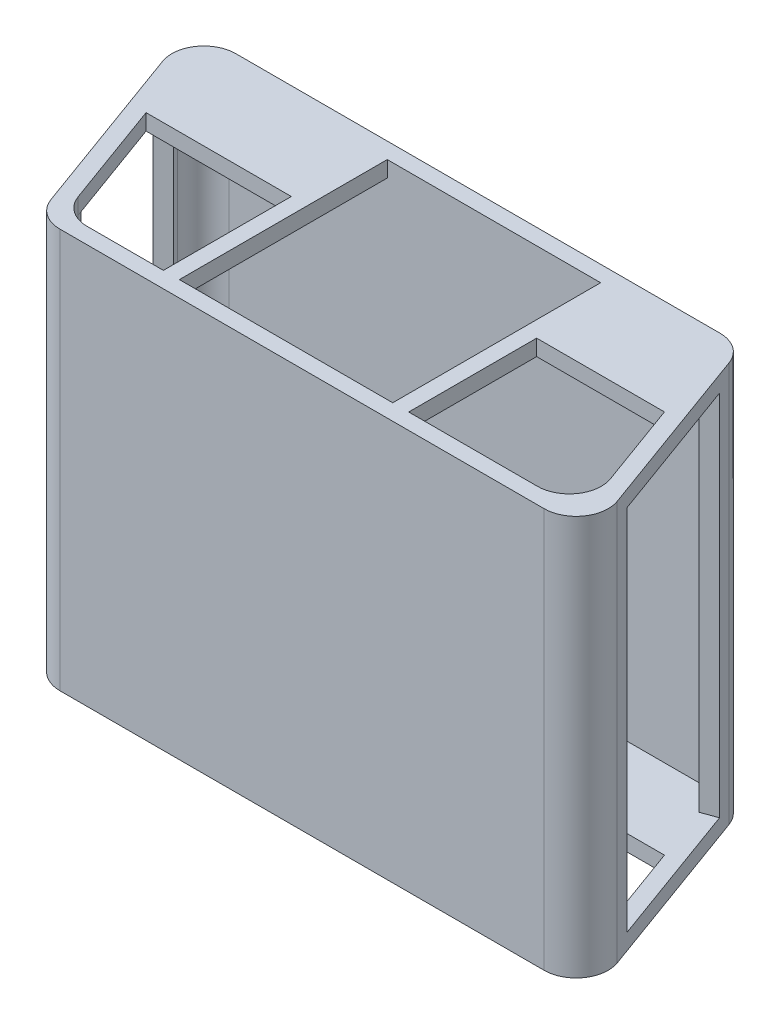
from build123d import *

# Parameters (mm, degrees)
BOSS_EXTRUDE1_DEPTH = 200
SKETCH2_W           = 2668.05
SKETCH2_H           = 2600
CUT_EXTRUDE1_DEPTH  = 230
BOSS_EXTRUDE2_DEPTH = 4600
SKETCH4_W           = 1941.19
SKETCH4_H           = 4600
CUT_EXTRUDE2_DEPTH  = 400
SKETCH5_W           = 1941.19
SKETCH5_H           = 4600
CUT_EXTRUDE3_DEPTH  = 400


with BuildPart() as part:
    # Sketch1 → Boss-Extrude1 (new body)
    with BuildSketch(Plane(origin=(0, 0, 0), x_dir=(1, 0, 0), z_dir=(0, 1, 0))):
        with BuildLine():
            Line((0, 0), (6056.75, 0))
            ThreePointArc((6056.75, 0), (6286.18, -72.339450634), (6432.625169, -263.192623242))
            Line((6432.625169, -263.192623242), (7233.3436263, -2463.197297837))
            ThreePointArc((7233.3436263, -2463.197297837), (7185.1256028, -2829.434418192), (6857.4656028, -3000.002675837))
            Line((6857.4656028, -3000.002675837), (800.7156028, -3000.002675837))
            ThreePointArc((800.7156028, -3000.002675837), (571.2856028, -2927.663225203), (424.8404338, -2736.810052595))
            Line((424.8404338, -2736.810052595), (-375.8780235, -536.805378))
            ThreePointArc((-375.8780235, -536.805378), (-327.66, -170.568257645), (0, 0))
        make_face()
    boss_extrude1 = extrude(amount=BOSS_EXTRUDE1_DEPTH)

    # Sketch2 → Cut-Extrude1 (cut)
    with BuildSketch(Plane.XZ):
        with BuildLine():
            Line((78.33570102, 1200.002675837), (564.884027877, 2536.812866415))
            ThreePointArc((564.884027877, 2536.812866415), (711.330655008, 2727.664144606), (940.760299746, 2800.002675837))
            Line((940.760299746, 2800.002675837), (1894.71570102, 2800.002675837))
            Line((1894.71570102, 2800.002675837), (1894.71570102, 1200.002675837))
            Line((1894.71570102, 1200.002675837), (78.33570102, 1200.002675837))
        make_face()
        with Locations((3428.74070102, 1500.002675837)):
            Rectangle(SKETCH2_W, SKETCH2_H)
        with BuildLine():
            Line((4962.76570102, 2800.002675837), (4962.76570102, 1200.008507233))
            Line((4962.76570102, 1200.008507233), (6560.75570102, 1200.008507233))
            Line((6560.75570102, 1200.008507233), (6947.716191633, 2263.197297837))
            ThreePointArc((6947.716191633, 2263.197297837), (6899.498168133, 2629.434418192), (6571.838168133, 2800.002675837))
            Line((6571.838168133, 2800.002675837), (4962.76570102, 2800.002675837))
        make_face()
    cut_extrude1 = extrude(amount=-CUT_EXTRUDE1_DEPTH, mode=Mode.SUBTRACT)

    # Sketch3 → Boss-Extrude2 (add)
    with BuildSketch(Plane(origin=(0, 200, 0), x_dir=(1, 0, 0), z_dir=(0, 1, 0))):
        with BuildLine():
            Line((0, 0), (6056.75, 0))
            ThreePointArc((6056.75, 0), (6286.18, -72.339450634), (6432.625169, -263.192623242))
            Line((6432.625169, -263.192623242), (7233.3436263, -2463.197297837))
            ThreePointArc((7233.3436263, -2463.197297837), (7185.1256028, -2829.434418192), (6857.4656028, -3000.002675837))
            Line((6857.4656028, -3000.002675837), (800.7156028, -3000.002675837))
            ThreePointArc((800.7156028, -3000.002675837), (571.2856028, -2927.663225203), (424.8404338, -2736.810052595))
            Line((424.8404338, -2736.810052595), (-375.8780235, -536.805378))
            ThreePointArc((-375.8780235, -536.805378), (-327.66, -170.568257645), (0, 0))
        make_face()
        with BuildLine():
            Line((564.884027877, -2536.812866415), (-147.984381612, -578.257593887))
            ThreePointArc((-147.984381612, -578.257593887), (-114.010573522, -320.192413074), (116.870963738, -200.002675837))
            Line((116.870963738, -200.002675837), (6024.574255854, -200.002675837))
            ThreePointArc((6024.574255854, -200.002675837), (6165.645943267, -244.482684413), (6255.692001343, -361.834291038))
            Line((6255.692001343, -361.834291038), (6947.716191633, -2263.197297837))
            ThreePointArc((6947.716191633, -2263.197297837), (6899.498168133, -2629.434418192), (6571.838168133, -2800.002675837))
            Line((6571.838168133, -2800.002675837), (940.760299746, -2800.002675837))
            ThreePointArc((940.760299746, -2800.002675837), (711.330655008, -2727.664144606), (564.884027877, -2536.812866415))
        make_face(mode=Mode.SUBTRACT)
    extrude(amount=BOSS_EXTRUDE2_DEPTH)

    # Mirror2: Boss-Extrude1, Cut-Extrude1 across plane
    add(boss_extrude1.mirror(Plane.ZX.offset(2500)))
    add(cut_extrude1.mirror(Plane.ZX.offset(2500)), mode=Mode.SUBTRACT)

    # Sketch4 → Cut-Extrude2 (cut)
    with BuildSketch(Plane(origin=(5595.593399291, 0, -2036.584270068), x_dir=(-0.3420134450000002, 0, -0.9396950587500351), z_dir=(0.9396950587500351, 0, -0.3420134450000002))):
        with Locations((-3617.960102004, 2500)):
            Rectangle(SKETCH4_W, SKETCH4_H)
    extrude(amount=-CUT_EXTRUDE2_DEPTH, mode=Mode.SUBTRACT)

    # Sketch5 → Cut-Extrude3 (cut)
    with BuildSketch(Plane(origin=(-504.433361217, 0, 183.594656624), x_dir=(0.34201344499999986, 0, 0.9396950587500352), z_dir=(-0.9396950587500353, 0, 0.34201344499999986))):
        with Locations((1546.4730235, 2500)):
            Rectangle(SKETCH5_W, SKETCH5_H)
    extrude(amount=-CUT_EXTRUDE3_DEPTH, mode=Mode.SUBTRACT)


solid = part.part
